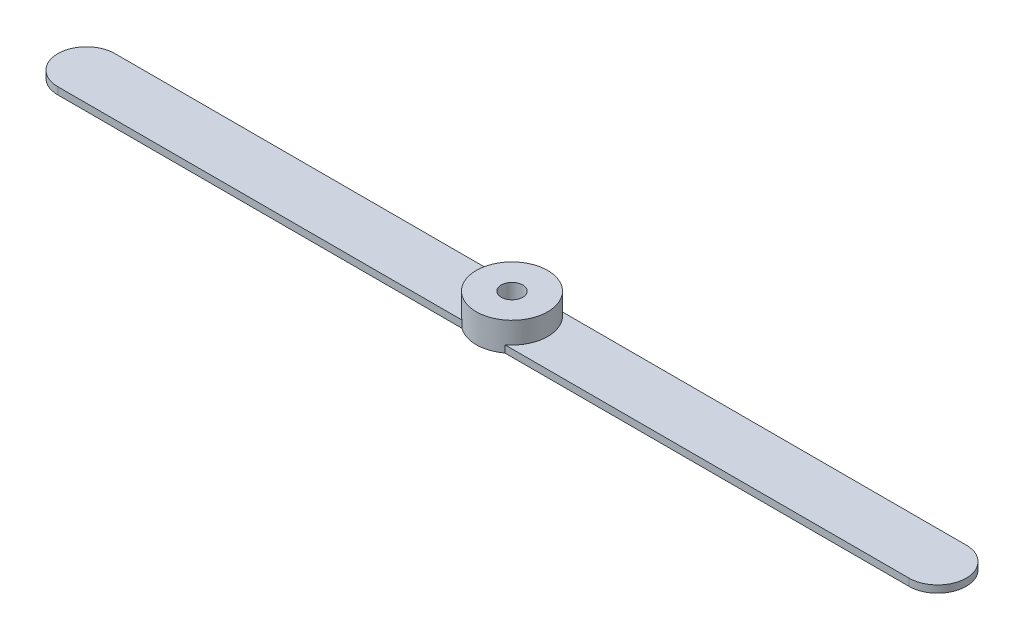
from build123d import *

# Parameters (mm, degrees)
SKETCH1_R           = 10
BOSS_EXTRUDE1_DEPTH = 8
BOSS_EXTRUDE3_DEPTH = 2
SKETCH6_R           = 3
CUT_EXTRUDE1_DEPTH  = 128.644036288


with BuildPart() as part:
    # Sketch1 → Boss-Extrude1 (new body)
    with BuildSketch(Plane(origin=(0, 0, 0), x_dir=(1, 0, 0), z_dir=(0, 1, 0))):
        Circle(SKETCH1_R)
    extrude(amount=BOSS_EXTRUDE1_DEPTH)

    # Sketch5 → Boss-Extrude3 (add)
    with BuildSketch(Plane(origin=(0, 0, 0), x_dir=(1, 0, 0), z_dir=(0, 1, 0))):
        with BuildLine():
            Line((-119, 8), (119, 8))
            ThreePointArc((119, 8), (127, 0), (119, -8))
            Line((119, -8), (-119, -8))
            ThreePointArc((-119, -8), (-127, 0), (-119, 8))
        make_face()
    extrude(amount=BOSS_EXTRUDE3_DEPTH)

    # Sketch6 → Cut-Extrude1 (cut, through all)
    with BuildSketch(Plane(origin=(0, 0, 0), x_dir=(1, 0, 0), z_dir=(0, 1, 0))):
        Circle(SKETCH6_R)
    extrude(amount=CUT_EXTRUDE1_DEPTH, mode=Mode.SUBTRACT)


solid = part.part
